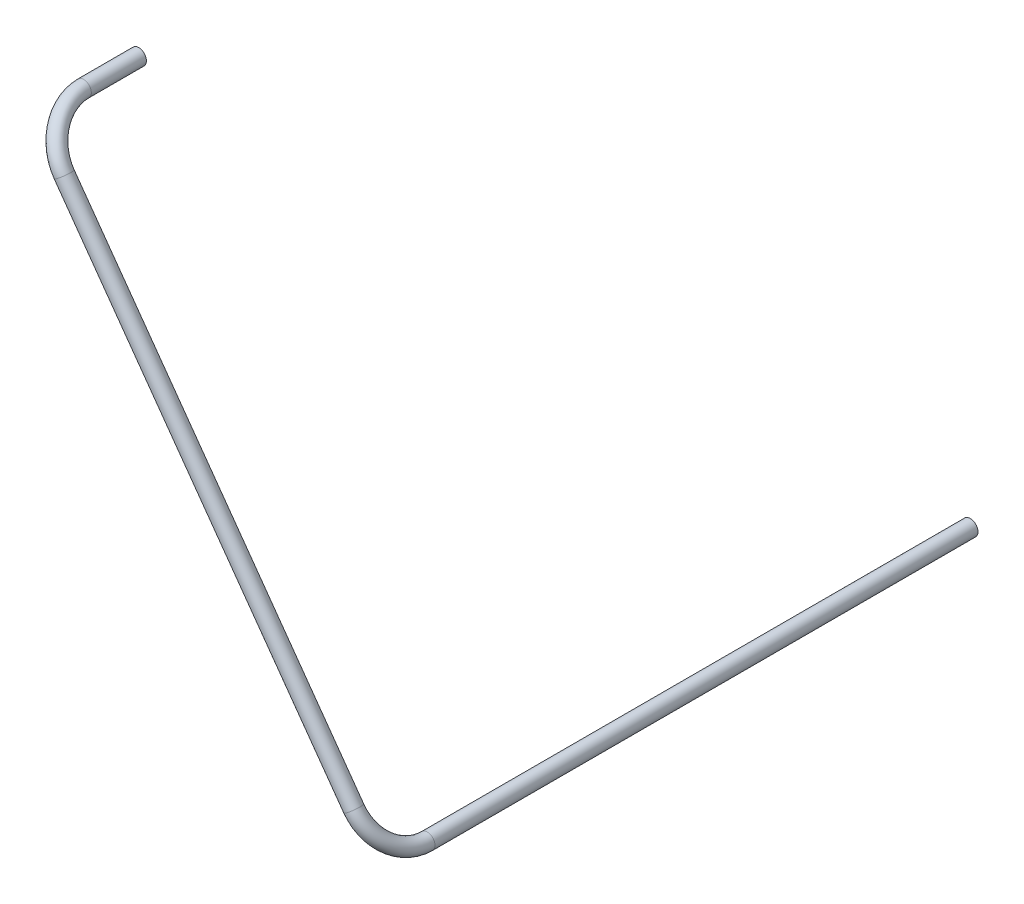
from build123d import *

# Parameters (mm, degrees)
PIPESKETCH_R   = 6.35
PIPESKETCH_R_2 = 5.1054


with BuildPart() as part:
    # ThinSweep: sweep along a curve in space
    with BuildLine() as thinsweep_path:
        Line((0, 0, 0), (0, 0, 45.224833485))
        ThreePointArc((0, 0, 45.224833485), (6.49695017, -9.072931676, 72.165601848), (22.181975386, -30.97692638, 83.324833485))
        Line((22.181975386, -30.97692638, 83.324833485), (259.82889592, -362.848684139, 83.324833485))
        ThreePointArc((282.010871306, -393.825610519, 45.224833485), (275.513921135, -384.752678843, 72.165601848), (259.82889592, -362.848684139, 83.324833485))
        Line((282.010871306, -393.825610519, -400.347253913), (282.010871306, -393.825610519, 45.224833485))
    # PipeSketch → ThinSweep (sweep)
    with BuildSketch(Plane.XY):
        Circle(PIPESKETCH_R)
        Circle(PIPESKETCH_R_2, mode=Mode.SUBTRACT)
    sweep(path=thinsweep_path.line)


solid = part.part
